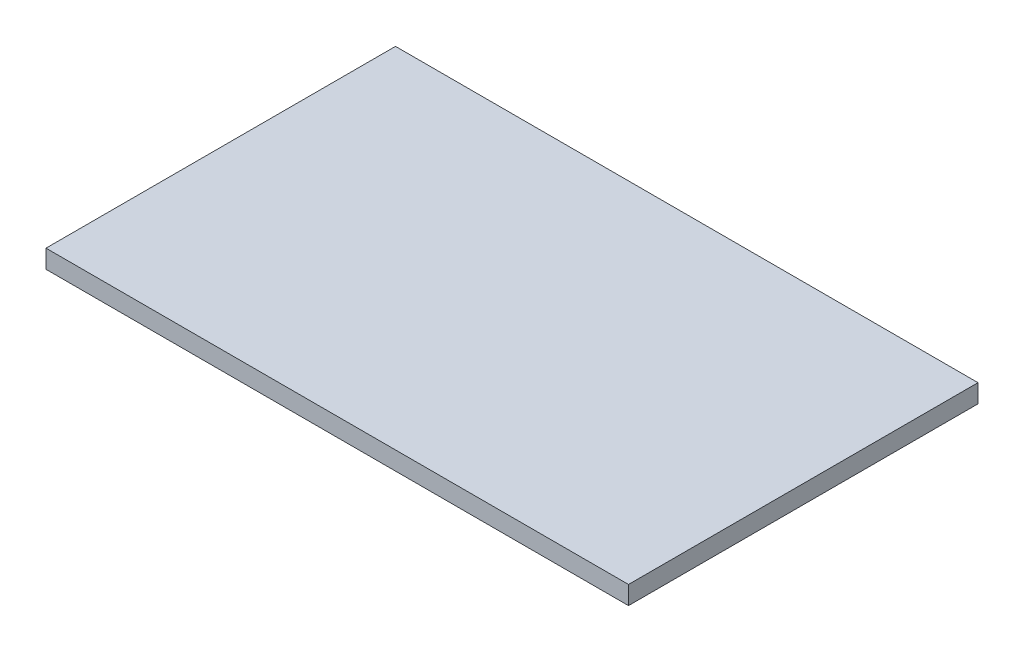
from build123d import *

# Parameters (mm, degrees)
SKETCH1_W           = 50.8
SKETCH1_H           = 30.48
BOSS_EXTRUDE1_DEPTH = 0.8


with BuildPart() as part:
    # Sketch1 → Boss-Extrude1 (new, symmetric)
    with BuildSketch(Plane(origin=(0, 0, 0), x_dir=(1, 0, 0), z_dir=(0, 1, 0))):
        Rectangle(SKETCH1_W, SKETCH1_H)
    extrude(amount=BOSS_EXTRUDE1_DEPTH, both=True)


solid = part.part
